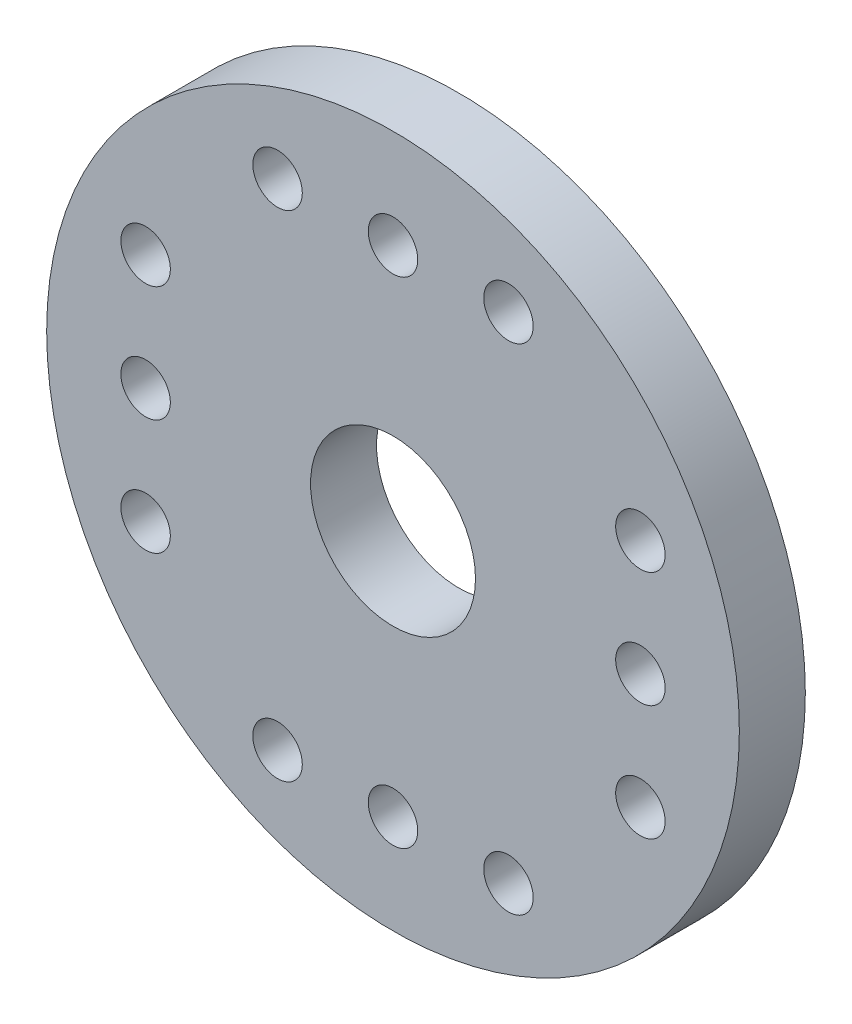
from build123d import *

# Parameters (mm, degrees)
CROQUIS1_R              = 10.5
CROQUIS1_R_2            = 0.75
CROQUIS1_R_3            = 2.5
SALIENTE_EXTRUIR1_DEPTH = 2


with BuildPart() as part:
    # Croquis1 → Saliente-Extruir1 (new body)
    with BuildSketch(Plane.XY):
        Circle(CROQUIS1_R)
        with Locations((0, 7.5)):
            Circle(CROQUIS1_R_2, mode=Mode.SUBTRACT)
        with Locations((-3.5, 7.5)):
            Circle(CROQUIS1_R_2, mode=Mode.SUBTRACT)
        with Locations((3.5, 7.5)):
            Circle(CROQUIS1_R_2, mode=Mode.SUBTRACT)
        with Locations((7.5, 3.5)):
            Circle(CROQUIS1_R_2, mode=Mode.SUBTRACT)
        with Locations((7.5, 0)):
            Circle(CROQUIS1_R_2, mode=Mode.SUBTRACT)
        with Locations((7.5, -3.5)):
            Circle(CROQUIS1_R_2, mode=Mode.SUBTRACT)
        with Locations((3.5, -7.5)):
            Circle(CROQUIS1_R_2, mode=Mode.SUBTRACT)
        with Locations((0, -7.5)):
            Circle(CROQUIS1_R_2, mode=Mode.SUBTRACT)
        with Locations((-3.5, -7.5)):
            Circle(CROQUIS1_R_2, mode=Mode.SUBTRACT)
        with Locations((-7.5, -3.5)):
            Circle(CROQUIS1_R_2, mode=Mode.SUBTRACT)
        with Locations((-7.5, 0)):
            Circle(CROQUIS1_R_2, mode=Mode.SUBTRACT)
        with Locations((-7.5, 3.5)):
            Circle(CROQUIS1_R_2, mode=Mode.SUBTRACT)
        Circle(CROQUIS1_R_3, mode=Mode.SUBTRACT)
    extrude(amount=SALIENTE_EXTRUIR1_DEPTH)


solid = part.part
